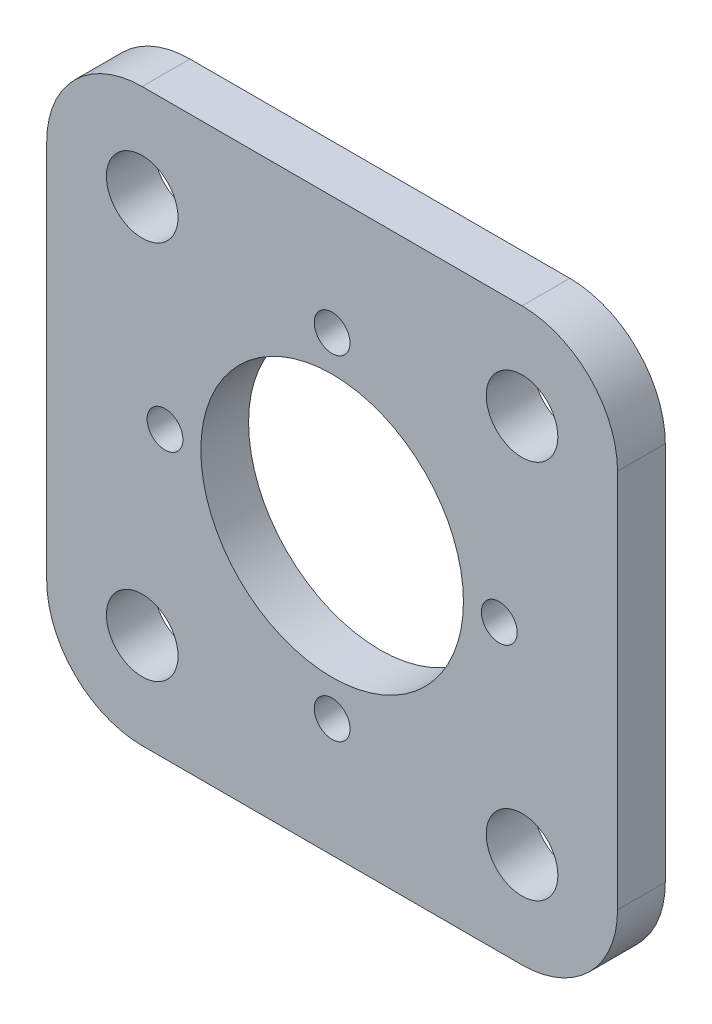
from build123d import *

# Parameters (mm, degrees)
SKETCH_1_R      = 11
SKETCH_1_R_2    = 1.5
SKETCH_1_R_3    = 3
EXTRUDE_1_DEPTH = 4


with BuildPart() as part:
    # 草图1 → 凸台-拉伸1 (new body)
    with BuildSketch(Plane.XY):
        with BuildLine():
            Line((-15.909902577, 23.909902577), (15.909902577, 23.909902577))
            ThreePointArc((15.909902577, 23.909902577), (21.566756826, 21.566756826), (23.909902577, 15.909902577))
            Line((23.909902577, 15.909902577), (23.909902577, -15.909902577))
            ThreePointArc((23.909902577, -15.909902577), (21.566756826, -21.566756826), (15.909902577, -23.909902577))
            Line((15.909902577, -23.909902577), (-15.909902577, -23.909902577))
            ThreePointArc((-15.909902577, -23.909902577), (-21.566756826, -21.566756826), (-23.909902577, -15.909902577))
            Line((-23.909902577, -15.909902577), (-23.909902577, 15.909902577))
            ThreePointArc((-23.909902577, 15.909902577), (-21.566756826, 21.566756826), (-15.909902577, 23.909902577))
        make_face()
        Circle(SKETCH_1_R, mode=Mode.SUBTRACT)
        with Locations((0, 14)):
            Circle(SKETCH_1_R_2, mode=Mode.SUBTRACT)
        with Locations((14, 0)):
            Circle(SKETCH_1_R_2, mode=Mode.SUBTRACT)
        with Locations((0, -14)):
            Circle(SKETCH_1_R_2, mode=Mode.SUBTRACT)
        with Locations((-14, 0)):
            Circle(SKETCH_1_R_2, mode=Mode.SUBTRACT)
        with Locations((15.909902577, 15.909902577)):
            Circle(SKETCH_1_R_3, mode=Mode.SUBTRACT)
        with Locations((15.909902577, -15.909902577)):
            Circle(SKETCH_1_R_3, mode=Mode.SUBTRACT)
        with Locations((-15.909902577, -15.909902577)):
            Circle(SKETCH_1_R_3, mode=Mode.SUBTRACT)
        with Locations((-15.909902577, 15.909902577)):
            Circle(SKETCH_1_R_3, mode=Mode.SUBTRACT)
    extrude(amount=EXTRUDE_1_DEPTH)


solid = part.part
